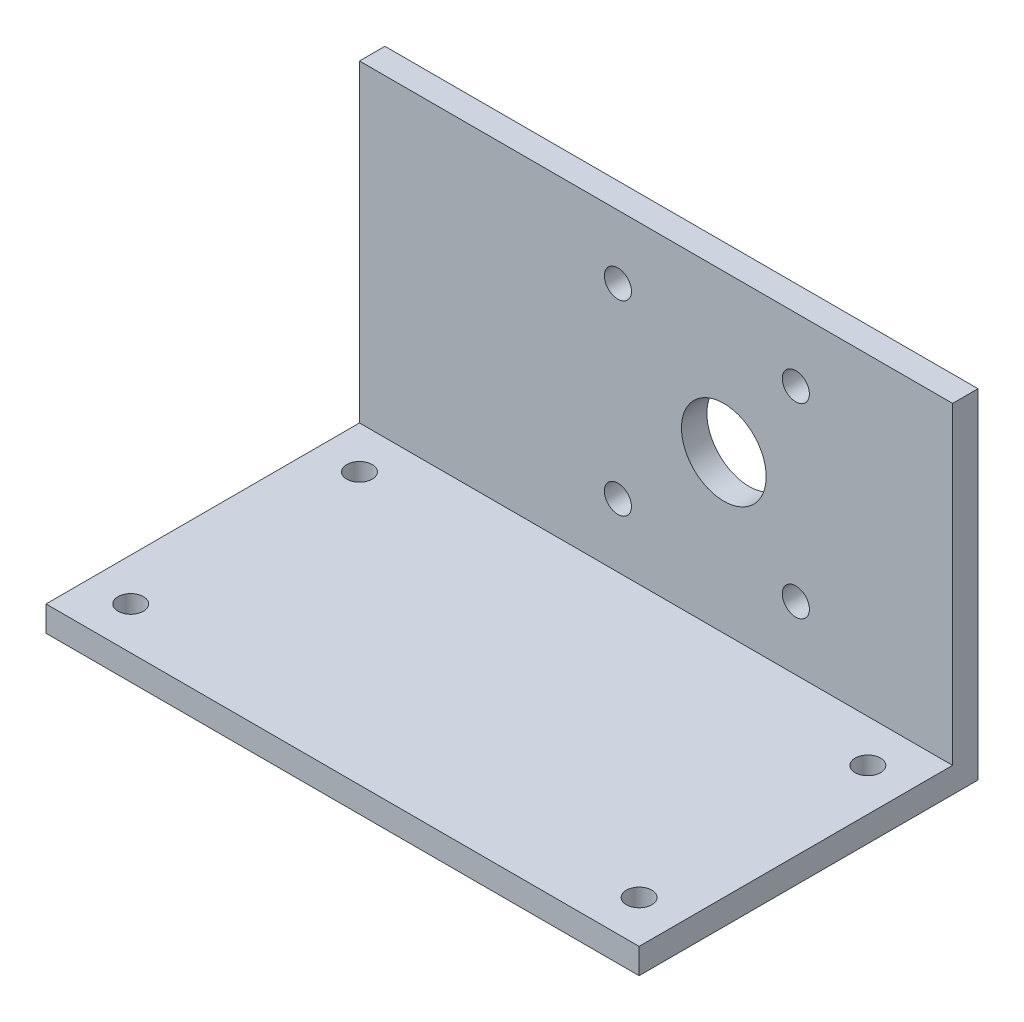
from build123d import *

# Parameters (mm, degrees)
EXTRUDE_1_DEPTH     = 70
SKETCH_2_R          = 5
SKETCH_2_R_2        = 1.6
CUT_EXTRUDE_1_DEPTH = 3
SKETCH_3_R          = 1.5
CUT_EXTRUDE_2_DEPTH = 3


with BuildPart() as part:
    # Эскиз1 → Бобышка-Вытянуть1 (new body)
    with BuildSketch(Plane(origin=(0, 0, 0), x_dir=(0, 0, -1), z_dir=(1, 0, 0))):
        Polygon((17, -17), (-20, -17), (-20, -20), (20, -20), (20, 20), (17, 20), align=None)
    extrude(amount=EXTRUDE_1_DEPTH)

    # Эскиз2 → Вырез-Вытянуть1 (cut)
    with BuildSketch(Plane.XY.offset(-17)):
        with Locations((43, 1.5)):
            Circle(SKETCH_2_R)
        with Locations((51.5, 12.5)):
            Circle(SKETCH_2_R_2)
        with Locations((30.5, 12.5)):
            Circle(SKETCH_2_R_2)
        with Locations((30.5, -9.5)):
            Circle(SKETCH_2_R_2)
        with Locations((51.5, -9.5)):
            Circle(SKETCH_2_R_2)
    extrude(amount=-CUT_EXTRUDE_1_DEPTH, mode=Mode.SUBTRACT)

    # Эскиз3 → Вырез-Вытянуть2 (cut)
    with BuildSketch(Plane(origin=(0, -17, 0), x_dir=(1, 0, 0), z_dir=(0, 1, 0))):
        with Locations(Location((65, -15, 0), (0, 0, 270))):
            Circle(SKETCH_3_R)
        with Locations(Location((65, 12, 0), (0, 0, 270))):
            Circle(SKETCH_3_R)
        with Locations(Location((5, -15, 0), (0, 0, 270))):
            Circle(SKETCH_3_R)
        with Locations(Location((5, 12, 0), (0, 0, 270))):
            Circle(SKETCH_3_R)
    extrude(amount=-CUT_EXTRUDE_2_DEPTH, mode=Mode.SUBTRACT)


solid = part.part
